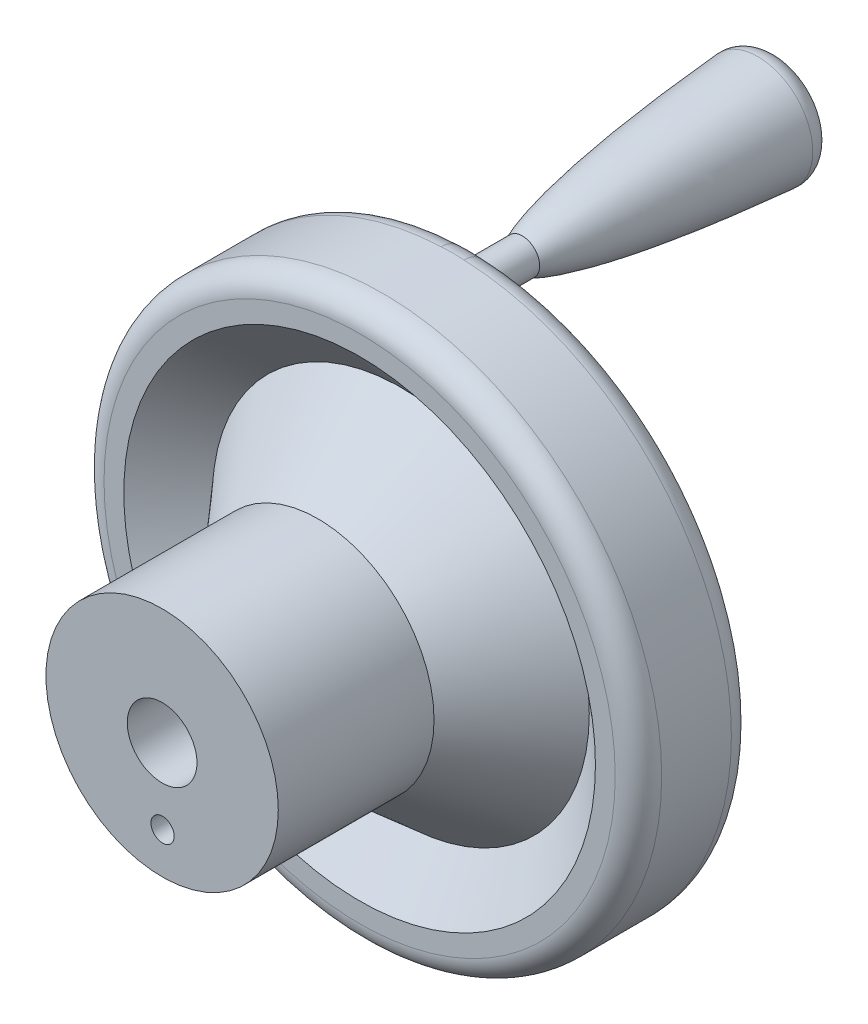
from build123d import *

# Parameters (mm, degrees)
SKETCH3_R                        = 2.38125
BOSS_EXTRUDE1_DEPTH              = 6.35
FILLET1_R                        = 2.54
FILLET3_R                        = 3.175
SKETCH5_R                        = 4.7625
SCREW_HOLE_CUT_EXTRUDE2_DEPTH    = 109.204676355
F_1_8_0_125_DIAMETER_HOLE1_D     = 3.175
F_1_8_0_125_DIAMETER_HOLE1_DEPTH = 12.7


with BuildPart() as part:
    # Sketch2 → Revolve1 (revolve)
    with BuildSketch(Plane(origin=(0, 0, 0), x_dir=(0, 0, -1), z_dir=(1, 0, 0)), mode=Mode.PRIVATE) as revolve1_sk:
        Polygon((32.624937731, 41.617673457), (21.280797071, 31.75), (0, 31.75), (0, 18.415), (12.7, 18.415), (12.7, 15.875), (26.9875, 15.875), (26.9875, 28.297792362), (42.8625, 42.106622913), (42.8625, 53.975), (26.9875, 53.975), (26.9875, 48.098622271), align=None)
    revolve(revolve1_sk.sketch.rotate(Axis((0, 15.875, 0), (0, 0, -1)), 90), axis=Axis((0, 15.875, 0), (0, 0, -1)))

    # Sketch3 → Boss-Extrude1 (add)
    with BuildSketch(Plane(origin=(0, 0, -42.8625), x_dir=(-1, 0, 0), z_dir=(0, 0, -1))):
        with Locations(Location((0, 48.867541329, 0), (0, 0, 180))):
            Circle(SKETCH3_R)
    extrude(amount=BOSS_EXTRUDE1_DEPTH)

    # Sketch4 → Revolve2 (revolve)
    with BuildSketch(Plane(origin=(0, 0, 0), x_dir=(0, 0, -1), z_dir=(1, 0, 0))):
        with BuildLine():
            add(Edge.make_bspline(
                [(84.1375, 56.557956647), (57.469839142, 54.737210229), (49.2125, 51.248791329)],
                knots=[5.239339857, 5.239339857, 5.239339857, 6.012248194, 6.012248194, 6.012248194], degree=2, weights=[1, 0.926251327, 1]))
            Line((49.2125, 51.248791329), (49.2125, 48.867541329))
            Line((49.2125, 48.867541329), (84.1375, 48.867541329))
            Line((84.1375, 48.867541329), (84.1375, 56.557956647))
        make_face()
    revolve(axis=Axis((0, 48.867541329, -49.2125), (0, 0, -1)))

    # Fillet1
    fillet1_edges = [part.edges().sort_by_distance(p)[0] for p in [
        (0, 41.177126011, -84.1375),
    ]]
    fillet(fillet1_edges, radius=FILLET1_R)

    # Fillet3
    fillet3_edges = [part.edges().sort_by_distance(p)[0] for p in [
        (-38.1, 15.875, -26.9875),
        (-38.1, 15.875, -42.8625),
        (-12.422792362, 15.875, -26.9875),
    ]]
    fillet(fillet3_edges, radius=FILLET3_R)

    # Sketch5 → screw hole Cut-Extrude2 (cut, through all)
    with BuildSketch(Plane.XY):
        with Locations((0, 15.875)):
            Circle(SKETCH5_R)
    extrude(amount=-SCREW_HOLE_CUT_EXTRUDE2_DEPTH, mode=Mode.SUBTRACT)

    # 1/8 (0.125) Diameter Hole1
    with Locations(Plane(origin=(-4.34210106, -24.39093033, 0), x_dir=(1, 0, 0), z_dir=(0, 0, 1))):
        with Locations((4.40560106, 30.01068033)):
            Hole(F_1_8_0_125_DIAMETER_HOLE1_D / 2, depth=F_1_8_0_125_DIAMETER_HOLE1_DEPTH)


solid = part.part
